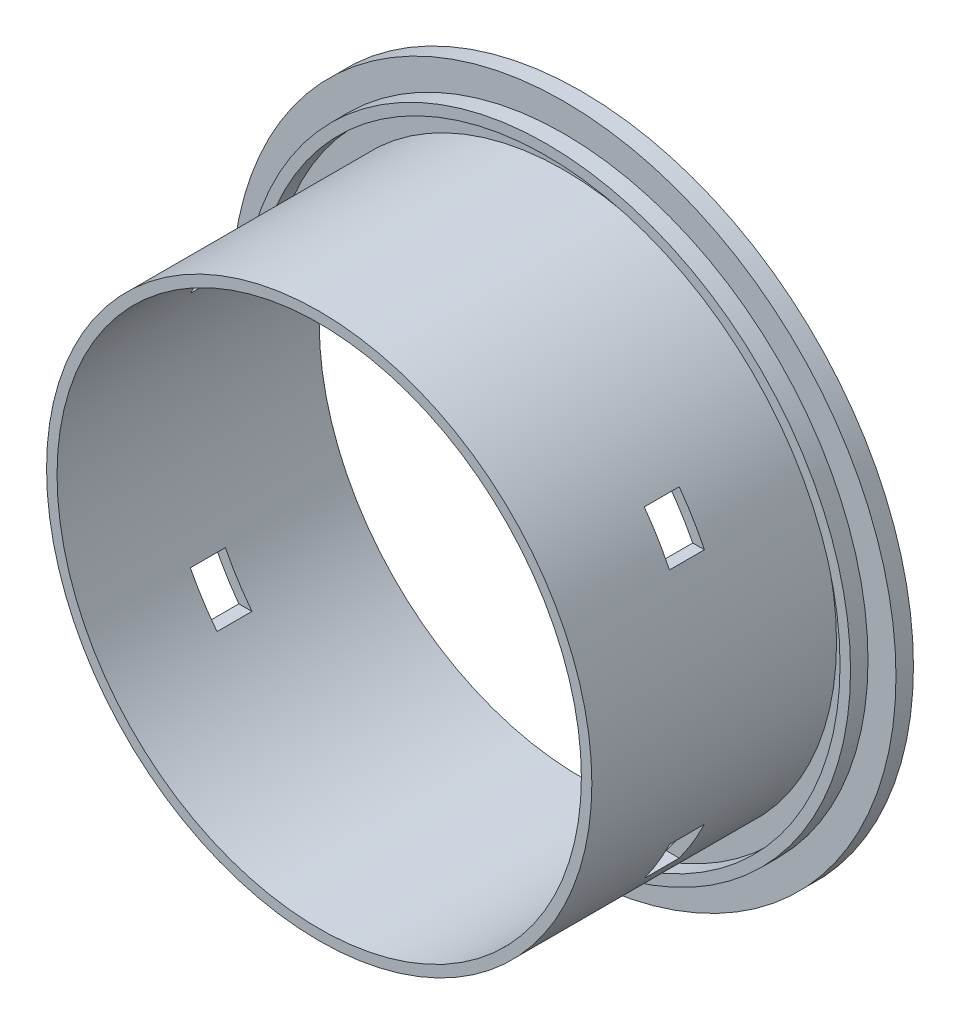
from build123d import *

# Parameters (mm, degrees)
SKETCH2_R               = 95
SKETCH2_R_2             = 75
BOSS_EXTRUDE1_DEPTH     = 5
SKETCH3_R               = 87
SKETCH3_R_2             = 84
BOSS_EXTRUDE2_DEPTH     = 10
SKETCH4_R               = 78
SKETCH4_R_2             = 75
BOSS_EXTRUDE3_DEPTH     = 70
CUT_EXTRUDE3_DEPTH      = 161.23420359
CUT_EXTRUDE3_DEPTH_BACK = 161.23420359
SKETCH6_W               = 10
SKETCH6_H               = 12
CUT_EXTRUDE4_DEPTH      = 161.23420359
CUT_EXTRUDE4_DEPTH_BACK = 161.23420359
SKETCH7_W               = 10
SKETCH7_H               = 12


with BuildPart() as part:
    # Sketch2 → Boss-Extrude1 (new body)
    with BuildSketch(Plane.XY):
        Circle(SKETCH2_R)
        Circle(SKETCH2_R_2, mode=Mode.SUBTRACT)
    extrude(amount=BOSS_EXTRUDE1_DEPTH)

    # Sketch3 → Boss-Extrude2 (add)
    with BuildSketch(Plane.XY):
        Circle(SKETCH3_R)
        Circle(SKETCH3_R_2, mode=Mode.SUBTRACT)
    extrude(amount=BOSS_EXTRUDE2_DEPTH)

    # Sketch4 → Boss-Extrude3 (add)
    with BuildSketch(Plane.XY.offset(5)):
        Circle(SKETCH4_R)
        Circle(SKETCH4_R_2, mode=Mode.SUBTRACT)
    extrude(amount=BOSS_EXTRUDE3_DEPTH)

    # Sketch6 → Cut-Extrude3 (cut, two sides: drawn at the far end of the back side and taken through both)
    with BuildSketch(Plane(origin=(10, 0, 0), x_dir=(0, 0, -1), z_dir=(1, 0, 0)).offset(-CUT_EXTRUDE3_DEPTH_BACK)):
        with Locations((-40, 40)):
            Rectangle(SKETCH6_W, SKETCH6_H)
    extrude(amount=CUT_EXTRUDE3_DEPTH + CUT_EXTRUDE3_DEPTH_BACK, mode=Mode.SUBTRACT)

    # Sketch7 → Cut-Extrude4 (cut, two sides: drawn at the far end of the back side and taken through both)
    with BuildSketch(Plane(origin=(10, 0, 0), x_dir=(0, 0, -1), z_dir=(1, 0, 0)).offset(-CUT_EXTRUDE4_DEPTH_BACK)):
        with Locations((-40, -40)):
            Rectangle(SKETCH7_W, SKETCH7_H)
    extrude(amount=CUT_EXTRUDE4_DEPTH + CUT_EXTRUDE4_DEPTH_BACK, mode=Mode.SUBTRACT)


solid = part.part
